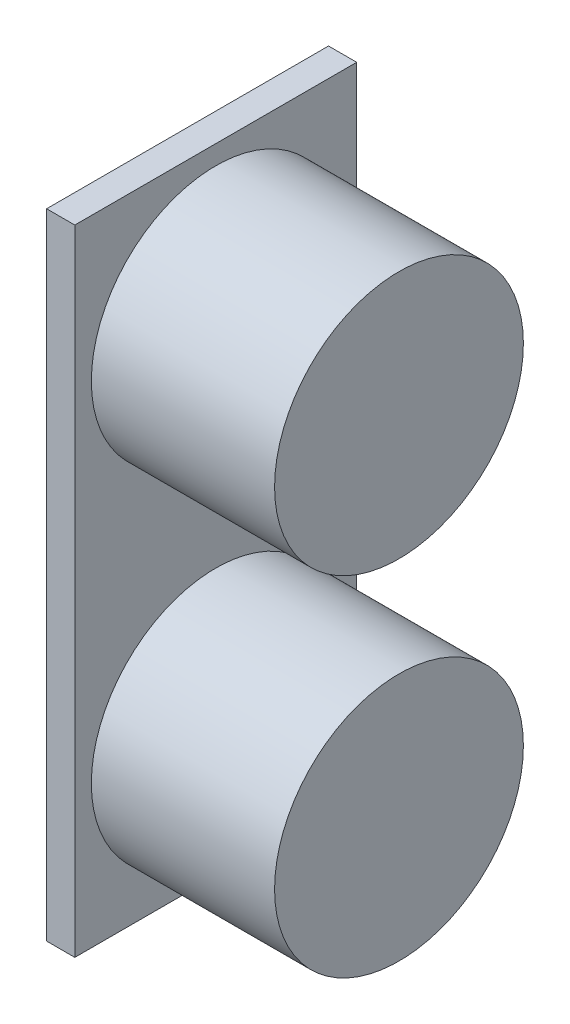
from build123d import *

# Parameters (mm, degrees)
SKETCH1_W           = 45
SKETCH1_H           = 20
BOSS_EXTRUDE1_DEPTH = 2
SKETCH2_R           = 8.826284226
BOSS_EXTRUDE3_DEPTH = 13
SKETCH2_5_R         = 8.826284226
BOSS_EXTRUDE4_DEPTH = 13


with BuildPart() as part:
    # Sketch1 → Boss-Extrude1 (new body)
    with BuildSketch(Plane.YZ):
        with Locations((22.5, 10)):
            Rectangle(SKETCH1_W, SKETCH1_H)
    extrude(amount=BOSS_EXTRUDE1_DEPTH)

    # Sketch2 → Boss-Extrude3 (add)
    with BuildSketch(Plane.YZ.offset(2)):
        with Locations((10.096276732, 10)):
            Circle(SKETCH2_R)
    extrude(amount=BOSS_EXTRUDE3_DEPTH)

    # Sketch2<5> → Boss-Extrude4 (add)
    with BuildSketch(Plane.YZ.offset(2)):
        with Locations((34.814683325, 10)):
            Circle(SKETCH2_5_R)
    extrude(amount=BOSS_EXTRUDE4_DEPTH)


solid = part.part
